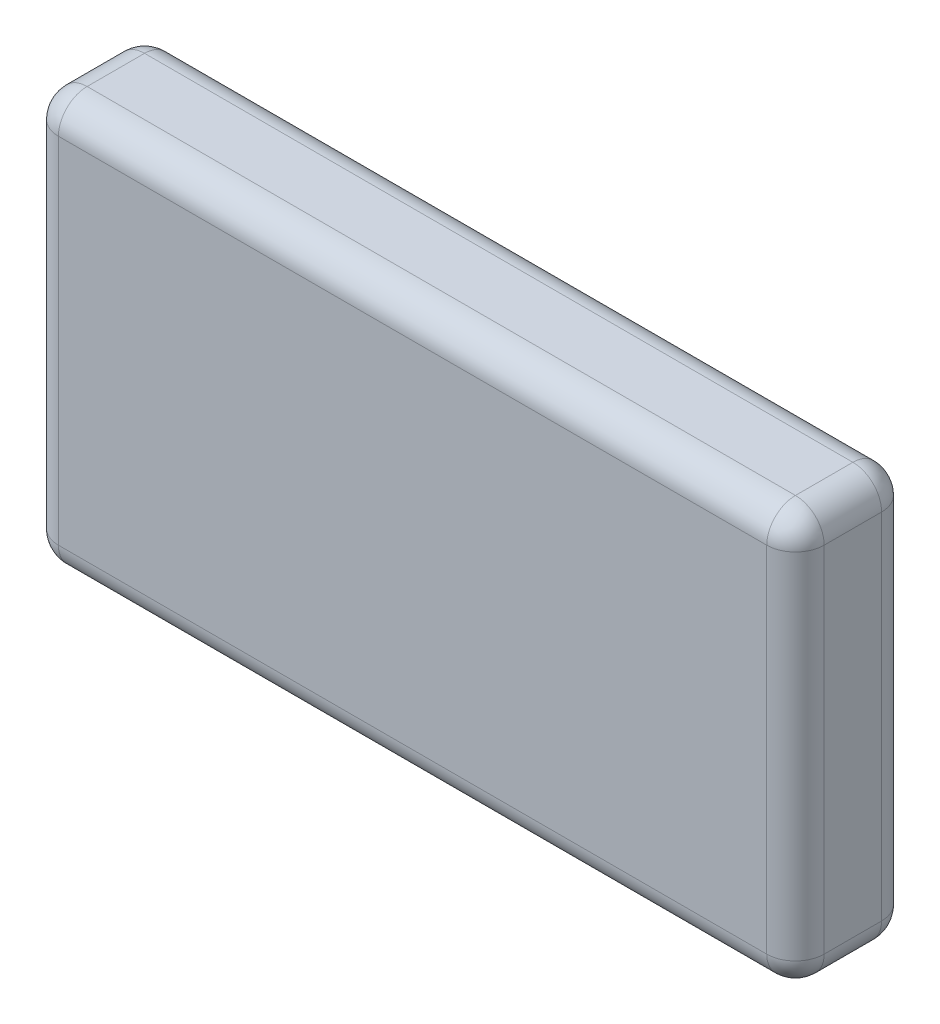
from build123d import *

# Parameters (mm, degrees)
SKETCH1_W           = 2000
SKETCH1_H           = 1075
BOSS_EXTRUDE1_DEPTH = 300
FILLET1_R           = 75


with BuildPart() as part:
    # Sketch1 → Boss-Extrude1 (new body)
    with BuildSketch(Plane.XY):
        Rectangle(SKETCH1_W, SKETCH1_H)
    extrude(amount=BOSS_EXTRUDE1_DEPTH)

    # Fillet1
    fillet1_edges = [part.edges().sort_by_distance(p)[0] for p in [
        (1000, 0, 300),
        (0, 537.5, 300),
        (-1000, 0, 300),
        (0, 537.5, 0),
        (1000, 0, 0),
        (0, -537.5, 0),
        (-1000, 0, 0),
        (0, -537.5, 300),
        (-1000, 537.5, 150),
        (1000, 537.5, 150),
        (1000, -537.5, 150),
        (-1000, -537.5, 150),
    ]]
    fillet(fillet1_edges, radius=FILLET1_R)


solid = part.part
